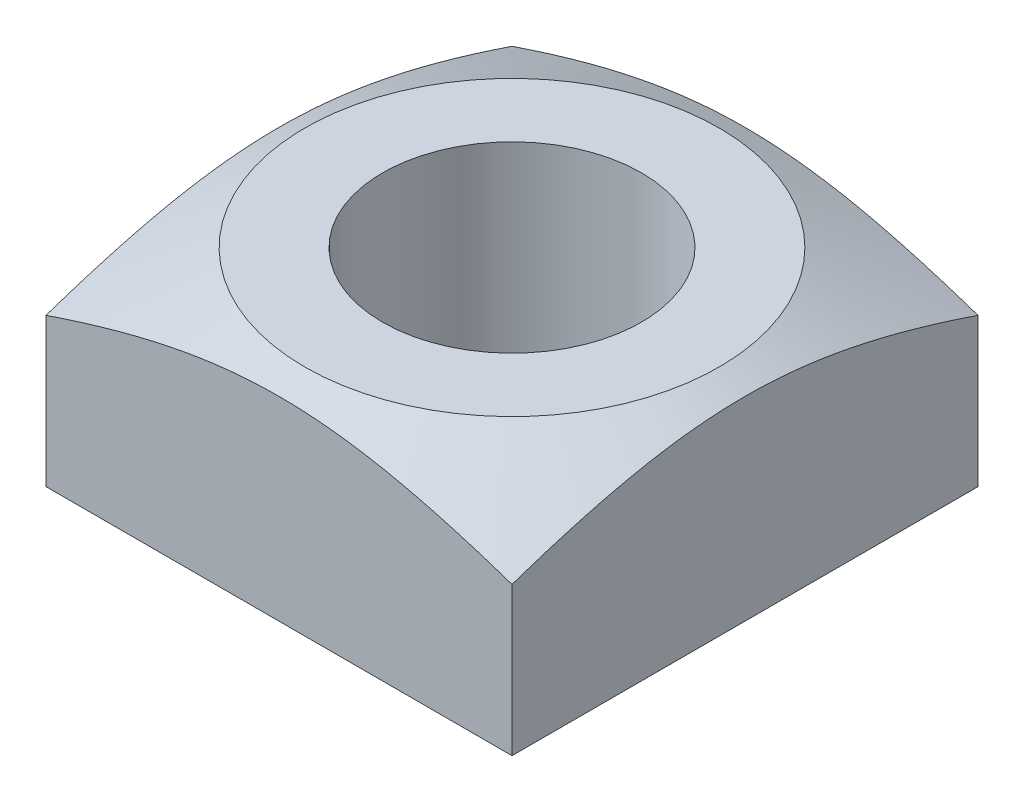
from build123d import *

# Parameters (mm, degrees)
SKETCH1_W           = 5.4
SKETCH1_H           = 5.4
SKETCH1_R           = 1.5
BOSS_EXTRUDE1_DEPTH = 2.4


with BuildPart() as part:
    # Sketch1 → Boss-Extrude1 (new body)
    with BuildSketch(Plane(origin=(0, 0, 0), x_dir=(1, 0, 0), z_dir=(0, 1, 0))):
        Rectangle(SKETCH1_W, SKETCH1_H)
        with Locations(Location((0, 0, 0), (0, 0, 270))):
            Circle(SKETCH1_R, mode=Mode.SUBTRACT)
    extrude(amount=BOSS_EXTRUDE1_DEPTH)

    # Sketch2 → Cut-Revolve1 (revolve, cut)
    with BuildSketch(Plane.XY, mode=Mode.PRIVATE) as cut_revolve1_sk:
        Polygon((-2.4, 2.4), (-4.9, 1.2), (-4.9, 2.4), align=None)
    revolve(cut_revolve1_sk.sketch.rotate(Axis((0, 2.4, 0), (0, -1, 0)), 134.999999961), axis=Axis((0, 2.4, 0), (0, -1, 0)), mode=Mode.SUBTRACT)


solid = part.part
